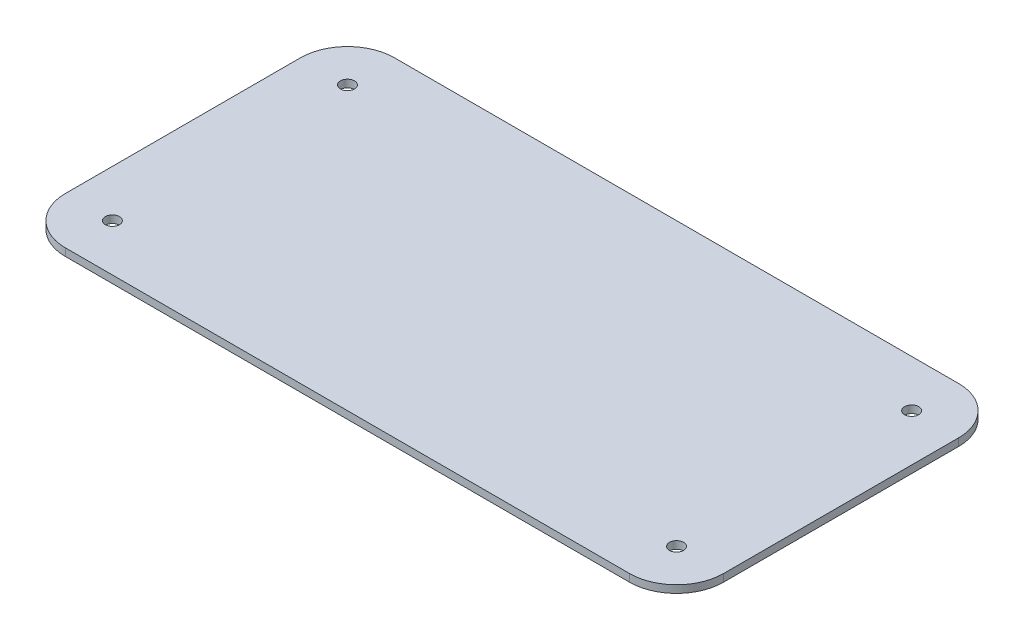
from build123d import *

# Parameters (mm, degrees)
BASE_EXTRUSION_DEPTH    = 8
ESQUISSE2_R             = 7.5
ENL_V_MAT_EXTRU_1_DEPTH = 8


with BuildPart() as part:
    # Esquisse1 → Base-Extrusion (new body)
    with BuildSketch(Plane(origin=(0, 0, 0), x_dir=(1, 0, 0), z_dir=(0, 1, 0))):
        with BuildLine():
            Line((50, 0), (650, 0))
            ThreePointArc((650, 0), (685.355339059, 14.644660941), (700, 50))
            Line((700, 50), (700, 300))
            ThreePointArc((700, 300), (685.355339059, 335.355339059), (650, 350))
            Line((650, 350), (50, 350))
            ThreePointArc((50, 350), (14.644660941, 335.355339059), (0, 300))
            Line((0, 300), (0, 50))
            ThreePointArc((0, 50), (14.644660941, 14.644660941), (50, 0))
        make_face()
    extrude(amount=BASE_EXTRUSION_DEPTH)

    # Esquisse2 → Enlèv. mat.-Extru.1 (cut)
    with BuildSketch(Plane(origin=(0, 8, 0), x_dir=(-1, 0, 0), z_dir=(0, 1, 0))):
        with Locations(Location((-50, -50, 0), (0, 0, 90))):
            Circle(ESQUISSE2_R)
        with Locations(Location((-50, -300, 0), (0, 0, 90))):
            Circle(ESQUISSE2_R)
        with Locations(Location((-650, -50, 0), (0, 0, 90))):
            Circle(ESQUISSE2_R)
        with Locations(Location((-650, -300, 0), (0, 0, 90))):
            Circle(ESQUISSE2_R)
    extrude(amount=-ENL_V_MAT_EXTRU_1_DEPTH, mode=Mode.SUBTRACT)


solid = part.part
